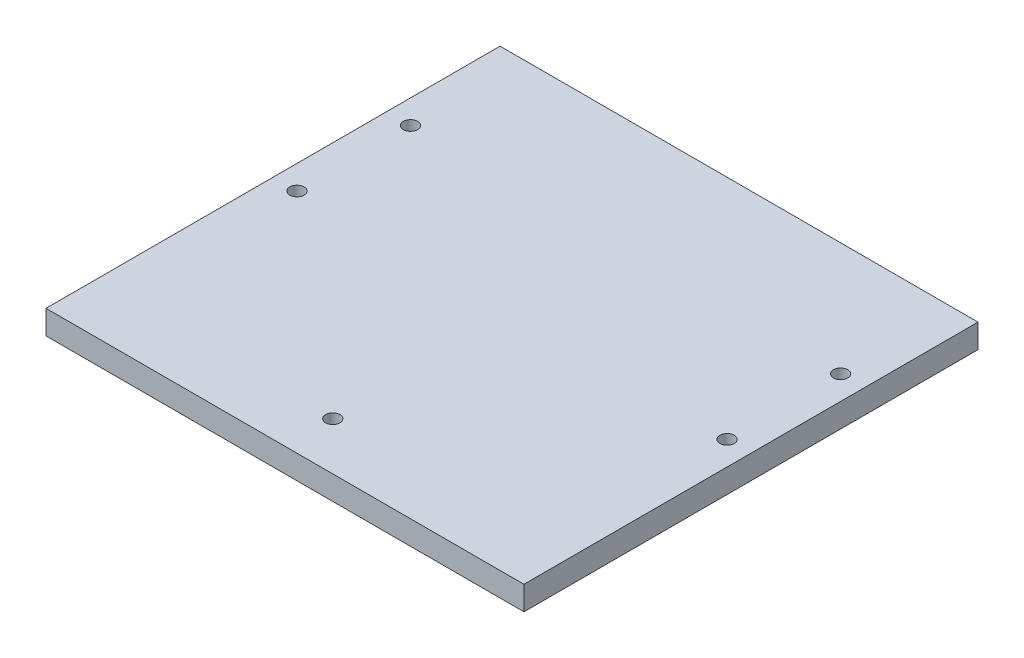
from build123d import *

# Parameters (mm, degrees)
SKETCH1_W           = 200
SKETCH1_H           = 190
BOSS_EXTRUDE1_DEPTH = 10
SKETCH2_W           = 20
SKETCH2_H           = 7
SKETCH2_W_2         = 16
SKETCH2_H_2         = 6
CUT_EXTRUDE1_DEPTH  = 10
SKETCH4_R           = 3
CUT_EXTRUDE2_DEPTH  = 10
SKETCH5_R           = 3
CUT_EXTRUDE3_DEPTH  = 10


with BuildPart() as part:
    # Sketch1 → Boss-Extrude1 (new body)
    with BuildSketch(Plane(origin=(0, 0, 0), x_dir=(1, 0, 0), z_dir=(0, 1, 0))):
        with Locations((100, 95)):
            Rectangle(SKETCH1_W, SKETCH1_H)
    extrude(amount=BOSS_EXTRUDE1_DEPTH)

    # Sketch2 → Cut-Extrude1 (cut)
    with BuildSketch(Plane(origin=(0, 0, -190), x_dir=(-1, 0, 0), z_dir=(0, 0, -1))):
        with Locations((-128, 5.5)):
            Rectangle(SKETCH2_W, SKETCH2_H)
        with Locations((-72, 5.5)):
            Rectangle(SKETCH2_W, SKETCH2_H)
        with Locations((-30, 5)):
            Rectangle(SKETCH2_W_2, SKETCH2_H_2)
        with Locations((-170, 5)):
            Rectangle(SKETCH2_W_2, SKETCH2_H_2)
    extrude(amount=-CUT_EXTRUDE1_DEPTH, mode=Mode.SUBTRACT)

    # Sketch4 → Cut-Extrude2 (cut)
    with BuildSketch(Plane(origin=(0, 0, 0), x_dir=(-1, 0, 0), z_dir=(0, -1, 0))):
        with Locations(Location((-10, 142.5, 0), (0, 0, 90))):
            Circle(SKETCH4_R)
        with Locations(Location((-10, 95, 0), (0, 0, 90))):
            Circle(SKETCH4_R)
        with Locations(Location((-190, 95, 0), (0, 0, 270))):
            Circle(SKETCH4_R)
        with Locations(Location((-190, 142.5, 0), (0, 0, 270))):
            Circle(SKETCH4_R)
    extrude(amount=-CUT_EXTRUDE2_DEPTH, mode=Mode.SUBTRACT)

    # Sketch5 → Cut-Extrude3 (cut)
    with BuildSketch(Plane(origin=(0, 10, 0), x_dir=(1, 0, 0), z_dir=(0, 1, 0))):
        with Locations(Location((100, 20, 0), (0, 0, 270))):
            Circle(SKETCH5_R)
    extrude(amount=-CUT_EXTRUDE3_DEPTH, mode=Mode.SUBTRACT)


solid = part.part
